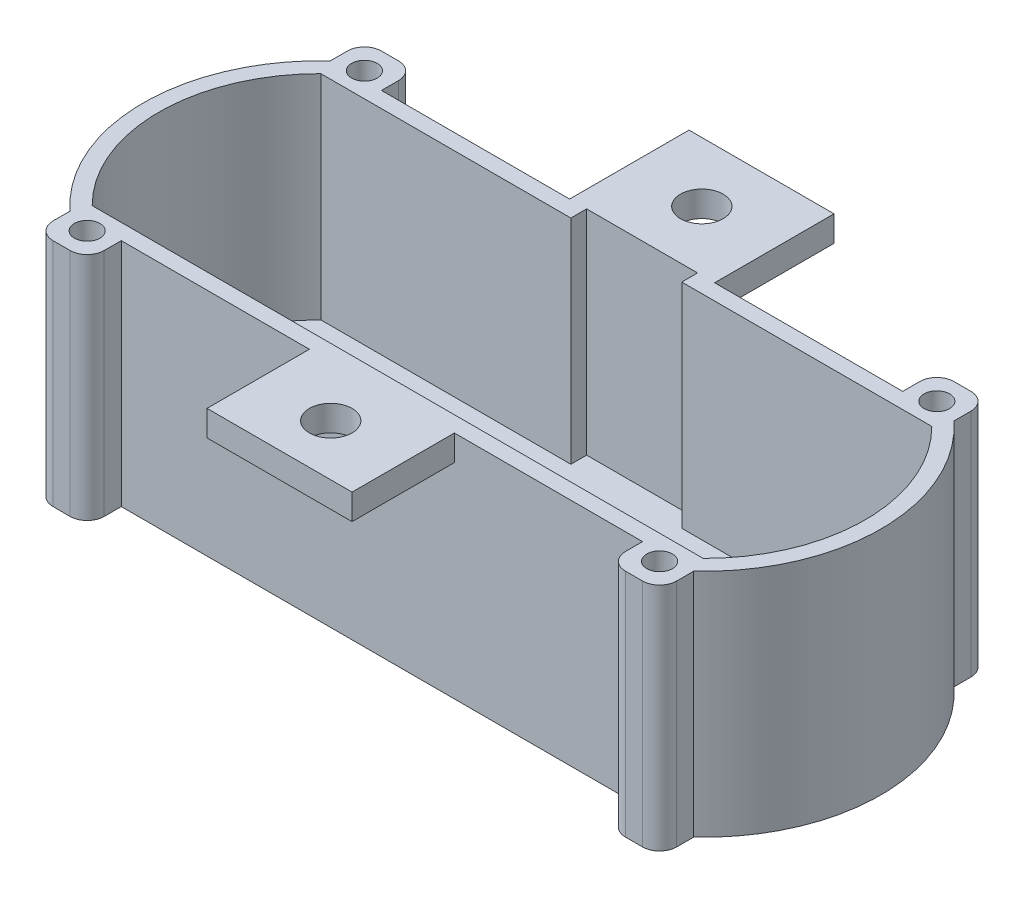
from build123d import *

# Parameters (mm, degrees)
BOSS_EXTRUDE2_DEPTH = 27
CUT_EXTRUDE3_DEPTH  = 25
SKETCH5_R           = 10
CUT_EXTRUDE4_DEPTH  = 2
SKETCH6_W           = 6
SKETCH6_H           = 4
BOSS_EXTRUDE3_DEPTH = 27
SKETCH7_R           = 1.5
CUT_EXTRUDE5_DEPTH  = 27
SKETCH15_W          = 17
SKETCH15_H          = 12
CUT_EXTRUDE6_DEPTH  = 24
FILLET1_R           = 2
CUT_EXTRUDE10_DEPTH = 25
SKETCH21_R          = 2.5
CUT_EXTRUDE11_DEPTH = 10


with BuildPart() as part:
    # Sketch1 → Boss-Extrude2 (new body)
    with BuildSketch(Plane(origin=(0, 0, 0), x_dir=(1, 0, 0), z_dir=(0, 1, 0))):
        with BuildLine():
            Line((8.5, 11.734748557), (8.5, 25.734748557))
            Line((8.5, 25.734748557), (-8.5, 25.734748557))
            Line((-8.5, 25.734748557), (-8.5, 11.734748557))
            Line((-8.5, 11.734748557), (-36.552303323, 11.734748557))
            ThreePointArc((-36.552303323, 11.734748557), (-43.25, -3.515251443), (-36.552303323, -18.765251443))
            Line((-36.552303323, -18.765251443), (-8.5, -18.765251443))
            Line((-8.5, -18.765251443), (-8.5, -30.765251443))
            Line((-8.5, -30.765251443), (8.5, -30.765251443))
            Line((8.5, -30.765251443), (8.5, -18.765251443))
            Line((8.5, -18.765251443), (36.552303323, -18.765251443))
            ThreePointArc((36.552303323, -18.765251443), (43.25, -3.515251443), (36.552303323, 11.734748557))
            Line((36.552303323, 11.734748557), (8.5, 11.734748557))
        make_face()
    extrude(amount=BOSS_EXTRUDE2_DEPTH)

    # Sketch4 → Cut-Extrude3 (cut)
    with BuildSketch(Plane(origin=(0, 27, 0), x_dir=(1, 0, 0), z_dir=(0, 1, 0))):
        with BuildLine():
            Line((6.5, 9.734748557), (35.75, 9.734748557))
            ThreePointArc((35.75, 9.734748557), (41.25, -3.515251443), (35.75, -16.765251443))
            Line((35.75, -16.765251443), (-35.75, -16.765251443))
            ThreePointArc((-35.75, -16.765251443), (-41.25, -3.515251443), (-35.75, 9.734748557))
            Line((-35.75, 9.734748557), (-6.5, 9.734748557))
            Line((-6.5, 9.734748557), (-6.5, 11.734748557))
            Line((-6.5, 11.734748557), (6.5, 11.734748557))
            Line((6.5, 11.734748557), (6.5, 9.734748557))
        make_face()
    extrude(amount=-CUT_EXTRUDE3_DEPTH, mode=Mode.SUBTRACT)

    # Sketch5 → Cut-Extrude4 (cut)
    with BuildSketch(Plane.XZ):
        with Locations(Location((0, 3.515251443, 0), (0, 0, 270))):
            Circle(SKETCH5_R)
    extrude(amount=-CUT_EXTRUDE4_DEPTH, mode=Mode.SUBTRACT)

    # Sketch6 → Boss-Extrude3 (add)
    with BuildSketch(Plane(origin=(0, 27, 0), x_dir=(1, 0, 0), z_dir=(0, 1, 0))):
        with Locations((-33.552303323, 13.734748557)):
            Rectangle(SKETCH6_W, SKETCH6_H)
        with Locations((-33.552303323, -20.765251443)):
            Rectangle(SKETCH6_W, SKETCH6_H)
        with Locations((33.552303323, -20.765251443)):
            Rectangle(SKETCH6_W, SKETCH6_H)
        with Locations((33.552303323, 13.734748557)):
            Rectangle(SKETCH6_W, SKETCH6_H)
    extrude(amount=-BOSS_EXTRUDE3_DEPTH)

    # Sketch7 → Cut-Extrude5 (cut)
    with BuildSketch(Plane(origin=(0, 27, 0), x_dir=(1, 0, 0), z_dir=(0, 1, 0))):
        with Locations(Location((-33.552303323, 12.734748557, 0), (0, 0, 270))):
            Circle(SKETCH7_R)
        with Locations(Location((-33.552303323, -19.765251443, 0), (0, 0, 90))):
            Circle(SKETCH7_R)
        with Locations(Location((33.552303323, -19.765251443, 0), (0, 0, 270))):
            Circle(SKETCH7_R)
        with Locations(Location((33.552303323, 12.734748557, 0), (0, 0, 90))):
            Circle(SKETCH7_R)
    extrude(amount=-CUT_EXTRUDE5_DEPTH, mode=Mode.SUBTRACT)

    # Sketch15 → Cut-Extrude6 (cut)
    with BuildSketch(Plane.XZ):
        with Locations((0, -19.734748557)):
            Rectangle(SKETCH15_W, SKETCH15_H)
        with Locations((0, 24.765251443)):
            Rectangle(SKETCH15_W, SKETCH15_H)
    extrude(amount=-CUT_EXTRUDE6_DEPTH, mode=Mode.SUBTRACT)

    # Fillet1
    fillet1_edges = [part.edges().sort_by_distance(p)[0] for p in [
        (36.552303323, 13.5, -15.734748557),
        (30.552303323, 13.5, -15.734748557),
        (-30.552303323, 13.5, -15.734748557),
        (-36.552303323, 13.5, -15.734748557),
        (-36.552303323, 13.5, 22.765251443),
        (-30.552303323, 13.5, 22.765251443),
        (30.552303323, 13.5, 22.765251443),
        (36.552303323, 13.5, 22.765251443),
    ]]
    fillet(fillet1_edges, radius=FILLET1_R)

    # Sketch20 → Cut-Extrude10 (cut)
    with BuildSketch(Plane(origin=(0, 27, 0), x_dir=(1, 0, 0), z_dir=(0, 1, 0))):
        with BuildLine():
            Line((6.5, 9.884748557), (-6.5, 9.884748557))
            Line((-6.5, 9.884748557), (-35.811855186, 9.884748557))
            ThreePointArc((-35.811855186, 9.884748557), (-41.4, -3.515251443), (-35.811855186, -16.915251443))
            Line((-35.811855186, -16.915251443), (35.811855186, -16.915251443))
            ThreePointArc((35.811855186, -16.915251443), (41.4, -3.515251443), (35.811855186, 9.884748557))
            Line((35.811855186, 9.884748557), (6.5, 9.884748557))
        make_face()
        with BuildLine():
            Line((35.75, 9.734748557), (6.5, 9.734748557))
            Line((6.5, 9.734748557), (-6.5, 9.734748557))
            Line((-6.5, 9.734748557), (-35.75, 9.734748557))
            ThreePointArc((-35.75, 9.734748557), (-41.25, -3.515251443), (-35.75, -16.765251443))
            Line((-35.75, -16.765251443), (35.75, -16.765251443))
            ThreePointArc((35.75, -16.765251443), (41.25, -3.515251443), (35.75, 9.734748557))
        make_face(mode=Mode.SUBTRACT)
    extrude(amount=-CUT_EXTRUDE10_DEPTH, mode=Mode.SUBTRACT)

    # Sketch21 → Cut-Extrude11 (cut)
    with BuildSketch(Plane(origin=(0, 27, 0), x_dir=(1, 0, 0), z_dir=(0, 1, 0))):
        with Locations(Location((0, 18.734748557, 0), (0, 0, 270))):
            Circle(SKETCH21_R)
        with Locations(Location((0, -24.765251443, 0), (0, 0, 270))):
            Circle(SKETCH21_R)
    extrude(amount=-CUT_EXTRUDE11_DEPTH, mode=Mode.SUBTRACT)


solid = part.part
